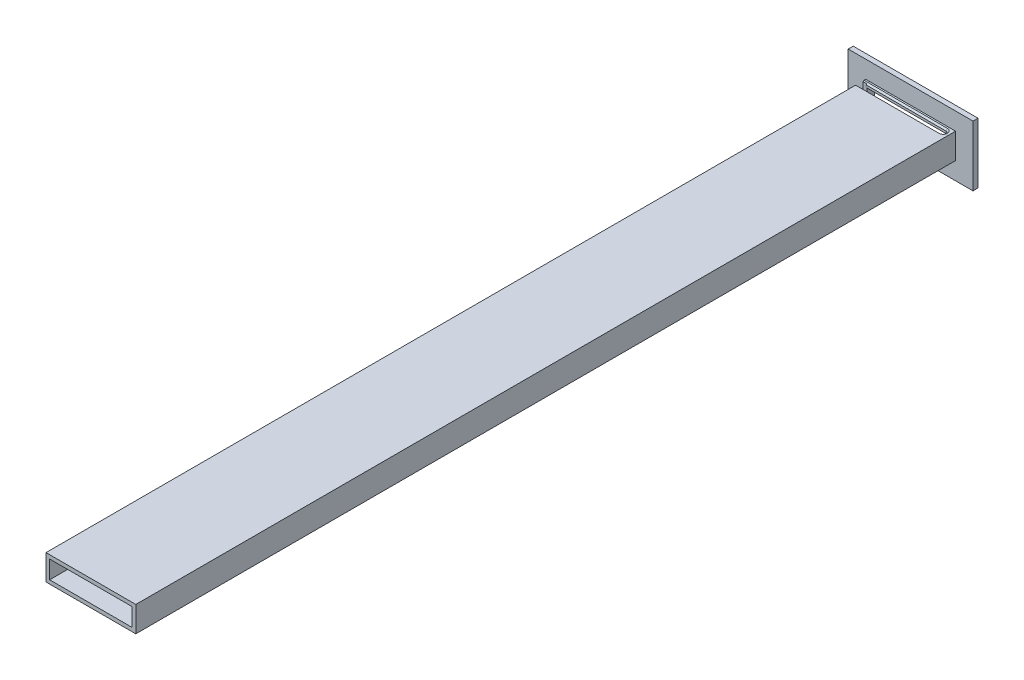
from build123d import *

# Parameters (mm, degrees)
SCHIZZO1_W                   = 35.931818182
SCHIZZO1_H                   = 10.2
SCHIZZO1_W_2                 = 33
SCHIZZO1_H_2                 = 7.2
ESTRUSIONE_ESTRUSIONE1_DEPTH = 330
SCHIZZO3_W                   = 2.7
SCHIZZO3_H                   = 3.2
TAGLIO_ESTRUSIONE1_DEPTH     = 34.465909091
TAGLIO_ESTRUSIONE2_DEPTH     = 1.5
SMUSSO2_SIZE                 = 0.6
SCHIZZO5_W                   = 49.931818182
SCHIZZO5_H                   = 24.2
SCHIZZO5_W_2                 = 35.931818182
SCHIZZO5_H_2                 = 10.2
ESTRUSIONE_ESTRUSIONE2_DEPTH = 2


with BuildPart() as part:
    # Schizzo1 → Estrusione-Estrusione1 (new body)
    with BuildSketch(Plane.XY):
        Rectangle(SCHIZZO1_W, SCHIZZO1_H)
        Rectangle(SCHIZZO1_W_2, SCHIZZO1_H_2, mode=Mode.SUBTRACT)
    extrude(amount=ESTRUSIONE_ESTRUSIONE1_DEPTH)

    # Schizzo3 → Taglio-Estrusione1 (cut)
    with BuildSketch(Plane.ZY.offset(17.965909091)):
        with Locations((4.35, 2)):
            Rectangle(SCHIZZO3_W, SCHIZZO3_H)
    extrude(amount=-TAGLIO_ESTRUSIONE1_DEPTH, mode=Mode.SUBTRACT)

    # Schizzo4 → Taglio-Estrusione2 (cut)
    with BuildSketch(Plane(origin=(0, 5.1, 0), x_dir=(1, 0, 0), z_dir=(0, 1, 0))):
        with BuildLine():
            Line((-16.5, -5.45), (15.4, -5.45))
            ThreePointArc((15.4, -5.45), (16.5, -4.35), (15.4, -3.25))
            Line((15.4, -3.25), (-16.5, -3.25))
            Line((-16.5, -3.25), (-16.5, -3))
            Line((-16.5, -3), (-17.965909091, -3))
            Line((-17.965909091, -3), (-17.965909091, -5.7))
            Line((-17.965909091, -5.7), (-16.5, -5.7))
            Line((-16.5, -5.7), (-16.5, -5.45))
        make_face()
    extrude(amount=-TAGLIO_ESTRUSIONE2_DEPTH, mode=Mode.SUBTRACT)

    # Smusso2
    smusso2_edges = [part.edges().sort_by_distance(p)[0] for p in [
        (-0.55, 5.1, 3.25),
        (16.5, 5.1, 4.35),
        (-0.55, 5.1, 5.45),
    ]]
    chamfer(smusso2_edges, length=SMUSSO2_SIZE)

    # Schizzo5 → Estrusione-Estrusione2 (add)
    with BuildSketch(Plane(origin=(0, 0, 0), x_dir=(-1, 0, 0), z_dir=(0, 0, -1))):
        Rectangle(SCHIZZO5_W, SCHIZZO5_H)
        Rectangle(SCHIZZO5_W_2, SCHIZZO5_H_2, mode=Mode.SUBTRACT)
    extrude(amount=-ESTRUSIONE_ESTRUSIONE2_DEPTH)


solid = part.part
